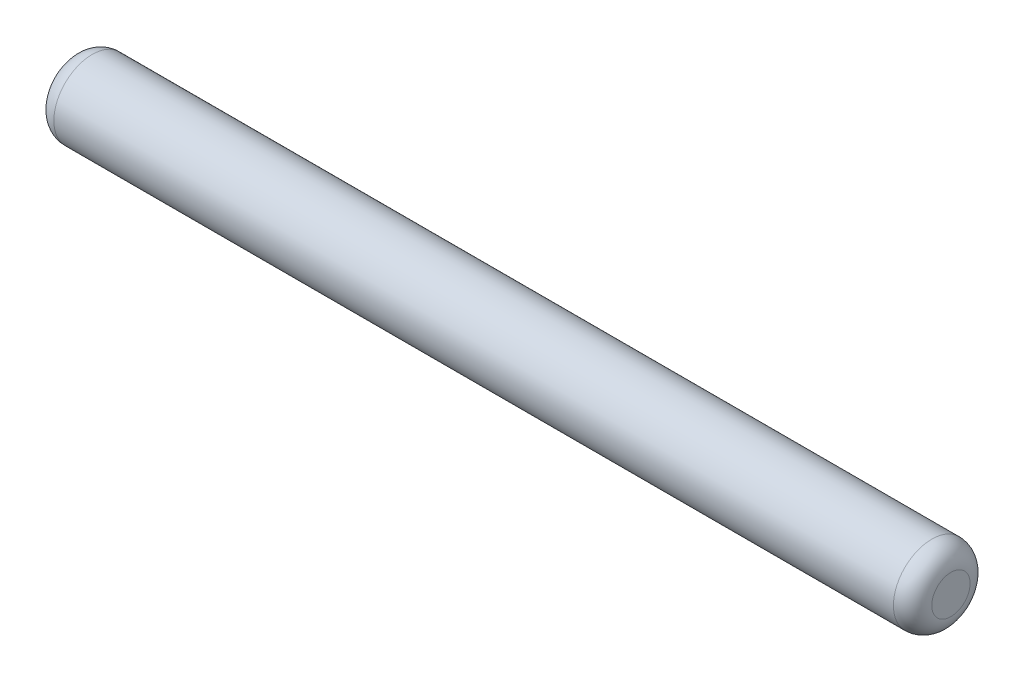
from build123d import *

# Parameters (mm, degrees)
BOSS_EXTRUDE1_DEPTH      = 11.45
BOSS_EXTRUDE1_DEPTH_BACK = 11.45
SKETCH1_R                = 1
FILLET1_R                = 0.5


with BuildPart() as part:
    # Sketch1 → Boss-Extrude1 (new, two sides: drawn at the far end of the back side and taken through both)
    with BuildSketch(Plane(origin=(0, 0, 0), x_dir=(0, 0, -1), z_dir=(1, 0, 0)).offset(-BOSS_EXTRUDE1_DEPTH_BACK)):
        Circle(SKETCH1_R)
    extrude(amount=BOSS_EXTRUDE1_DEPTH + BOSS_EXTRUDE1_DEPTH_BACK)

    # Fillet1
    fillet1_edges = [part.edges().sort_by_distance(p)[0] for p in [
        (-11.45, 0, 1),
        (11.45, 0, 1),
    ]]
    fillet(fillet1_edges, radius=FILLET1_R)


solid = part.part
